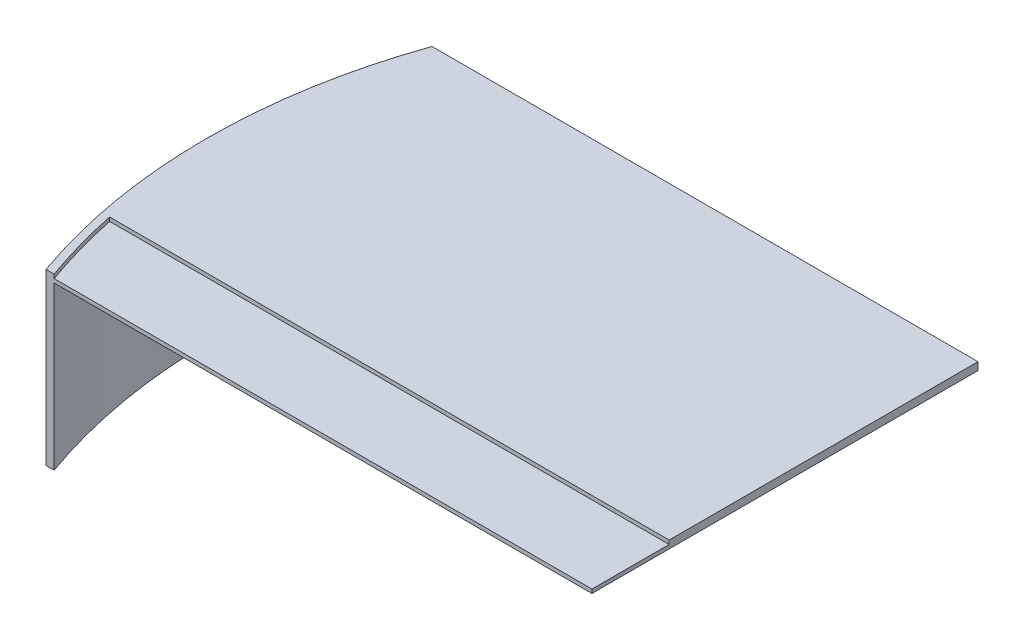
from build123d import *

# Parameters (mm, degrees)
BOSS_EXTRUDE1_DEPTH = 44
SHELL1_T            = -2
CUT_EXTRUDE1_START  = -1
CUT_EXTRUDE1_DEPTH  = 1


with BuildPart() as part:
    # Sketch1 → Boss-Extrude1 (new body)
    with BuildSketch(Plane(origin=(0, 0, 0), x_dir=(1, 0, 0), z_dir=(0, 1, 0))):
        with BuildLine():
            Line((0, 0), (0, -50))
            Line((0, -50), (-141.421356237, -50))
            ThreePointArc((-141.421356237, -50), (-150, 0), (-141.421356237, 50))
            Line((-141.421356237, 50), (0, 50))
            Line((0, 50), (0, 0))
        make_face()
    extrude(amount=BOSS_EXTRUDE1_DEPTH)

    # Shell1
    shell1_openings = [part.faces().sort_by_distance(p)[0] for p in [
        (-70.710678119, 22, -50),
        (-73.609024715, 0, 0),
        (0, 22, 0),
        (-70.710678119, 22, 50),
    ]]
    offset(amount=SHELL1_T, openings=shell1_openings, kind=Kind.INTERSECTION)

    # Sketch2 → Cut-Extrude1 (cut)
    with BuildSketch(Plane(origin=(0, 44, 0), x_dir=(-1, 0, 0), z_dir=(0, 1, 0)).offset(CUT_EXTRUDE1_START)):
        with BuildLine():
            ThreePointArc((144.927568116, 30), (142.464303142, 40.098906848), (139.298241195, 50))
            Line((139.298241195, 50), (0, 50))
            Line((0, 50), (0, 30))
            Line((0, 30), (144.927568116, 30))
        make_face()
    extrude(amount=CUT_EXTRUDE1_DEPTH, mode=Mode.SUBTRACT)


solid = part.part
